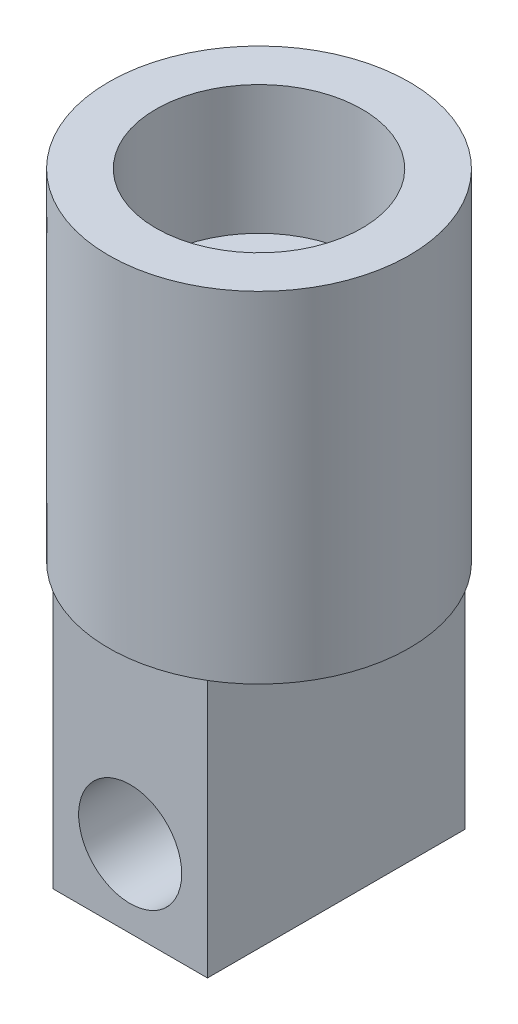
from build123d import *

# Parameters (mm, degrees)
ESQUISSE1_W             = 30
ESQUISSE1_H             = 50
ESQUISSE1_R             = 10
BOSS_EXTRU_1_DEPTH      = 50
ESQUISSE3_R             = 29.154759474
BOSS_EXTRU_2_DEPTH      = 66
ESQUISSE4_R             = 20
ENL_V_MAT_EXTRU_1_DEPTH = 25


with BuildPart() as part:
    # Esquisse1 → Boss.-Extru.1 (new body)
    with BuildSketch(Plane.XY):
        with Locations((-293.597239891, -30)):
            Rectangle(ESQUISSE1_W, ESQUISSE1_H)
        with Locations((-293.597239891, -40)):
            Circle(ESQUISSE1_R, mode=Mode.SUBTRACT)
    extrude(amount=BOSS_EXTRU_1_DEPTH)

    # Esquisse3 → Boss.-Extru.2 (add)
    with BuildSketch(Plane(origin=(0, -5, 0), x_dir=(1, 0, 0), z_dir=(0, 1, 0))):
        with Locations(Location((-293.597239891, -25, 0), (0, 0, 59.036243468))):
            Circle(ESQUISSE3_R)
    extrude(amount=BOSS_EXTRU_2_DEPTH)

    # Esquisse4 → Enlèv. mat.-Extru.1 (cut)
    with BuildSketch(Plane(origin=(0, 61, 0), x_dir=(1, 0, 0), z_dir=(0, 1, 0))):
        with Locations(Location((-293.597239891, -25, 0), (0, 0, 270))):
            Circle(ESQUISSE4_R)
    extrude(amount=-ENL_V_MAT_EXTRU_1_DEPTH, mode=Mode.SUBTRACT)


solid = part.part
